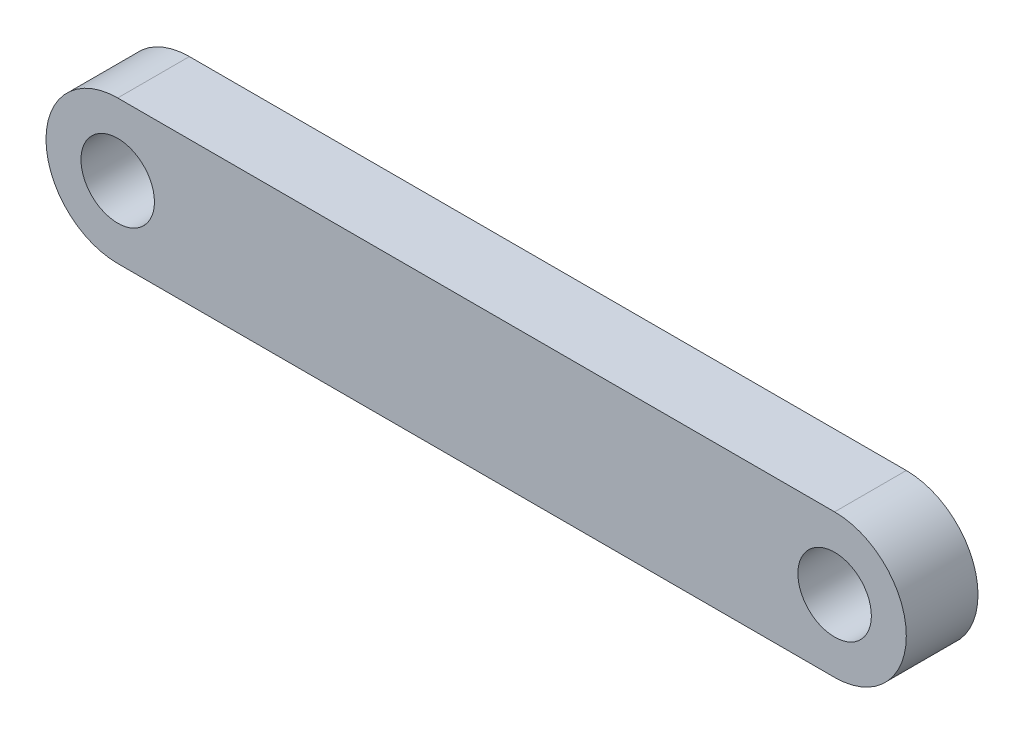
from build123d import *

# Parameters (mm, degrees)
SKETCH_1_R      = 2.05
EXTRUDE_1_DEPTH = 4


with BuildPart() as part:
    # 스케치1 → 보스-돌출1 (new body)
    with BuildSketch(Plane.XY):
        with BuildLine():
            Line((0, 4), (40, 4))
            ThreePointArc((40, 4), (44, 0), (40, -4))
            Line((40, -4), (0, -4))
            ThreePointArc((0, -4), (-4, 0), (0, 4))
        make_face()
        Circle(SKETCH_1_R, mode=Mode.SUBTRACT)
        with Locations((40, 0)):
            Circle(SKETCH_1_R, mode=Mode.SUBTRACT)
    extrude(amount=EXTRUDE_1_DEPTH)


solid = part.part
